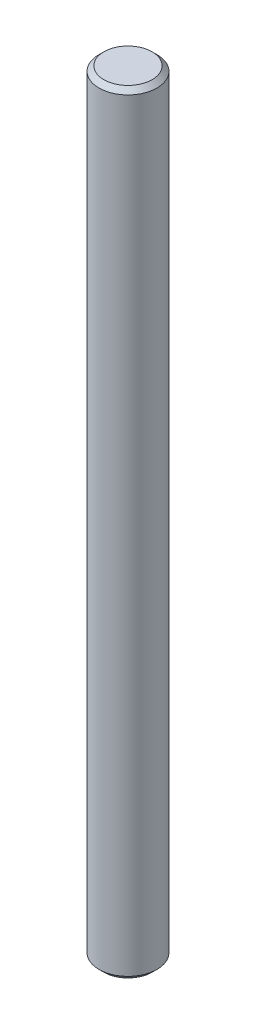
from build123d import *

# Parameters (mm, degrees)
SKETCH2_R           = 1.5
BOSS_EXTRUDE1_DEPTH = 40
CHAMFER1_SIZE       = 0.25


with BuildPart() as part:
    # Sketch2 → Boss-Extrude1 (new body)
    with BuildSketch(Plane(origin=(0, 0, 0), x_dir=(1, 0, 0), z_dir=(0, 1, 0))):
        with Locations(Location((0, 0, 0), (0, 0, 270))):
            Circle(SKETCH2_R)
    extrude(amount=BOSS_EXTRUDE1_DEPTH)

    # Chamfer1
    chamfer1_edges = [part.edges().sort_by_distance(p)[0] for p in [
        (0, 0, -1.5),
        (0, 40, -1.5),
    ]]
    chamfer(chamfer1_edges, length=CHAMFER1_SIZE)


solid = part.part
